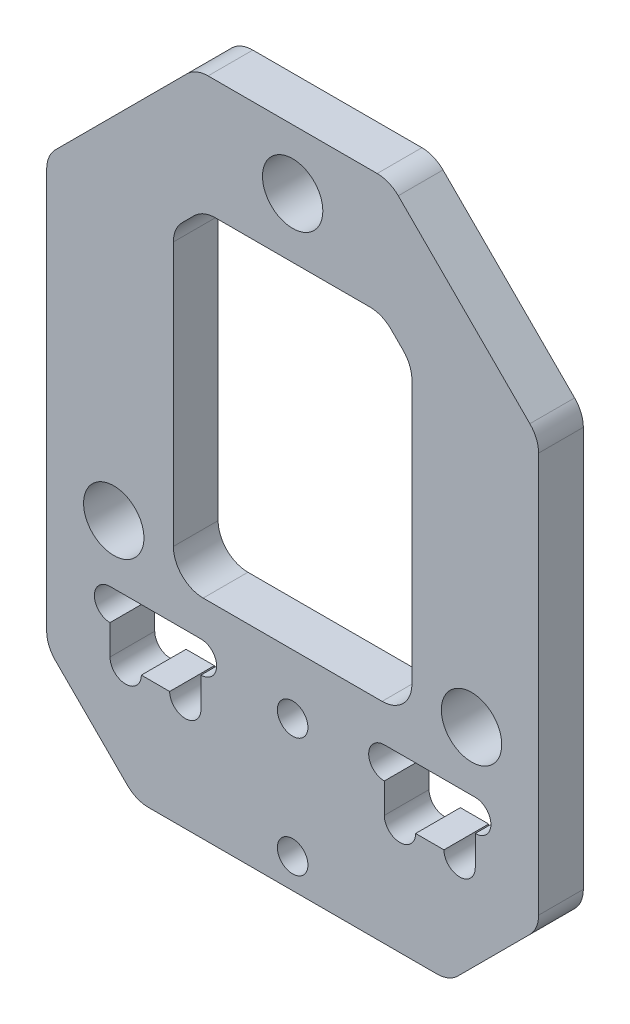
from build123d import *

# Parameters (mm, degrees)
SKETCH_1_W          = 33
SKETCH_1_H          = 44.5
EXTRUDE_1_DEPTH     = 3
SKETCH_2_R          = 2.025
SKETCH_2_R_2        = 1.025
CUT_EXTRUDE_1_DEPTH = 13
CHAMFER_1_SIZE      = 10
CUT_EXTRUDE_2_DEPTH = 13
FILLET_1_R          = 2
CHAMFER_2_SIZE      = 6
FILLET_2_R          = 2
SKETCH_4_W          = 6.1
SKETCH_4_H          = 4.1
CUT_EXTRUDE_3_DEPTH = 3
SKETCH_5_R          = 1.05
CUT_EXTRUDE_4_DEPTH = 3


with BuildPart() as part:
    # 草图1 → 凸台-拉伸1 (new body)
    with BuildSketch(Plane.XY):
        Rectangle(SKETCH_1_W, SKETCH_1_H)
    extrude(amount=EXTRUDE_1_DEPTH)

    # 草图2 → 切除-拉伸1 (cut)
    with BuildSketch(Plane.XY.offset(3)):
        with Locations((12, -6.75)):
            Circle(SKETCH_2_R)
        with Locations((-12, -6.75)):
            Circle(SKETCH_2_R)
        with Locations((0, 18.25)):
            Circle(SKETCH_2_R)
        with Locations((0, -12.25)):
            Circle(SKETCH_2_R_2)
        with Locations((0, -20.25)):
            Circle(SKETCH_2_R_2)
    extrude(amount=-CUT_EXTRUDE_1_DEPTH, mode=Mode.SUBTRACT)

    # 倒角1
    chamfer_1_edges = [part.edges().sort_by_distance(p)[0] for p in [
        (-16.5, 22.25, 1.5),
        (16.5, 22.25, 1.5),
    ]]
    chamfer(chamfer_1_edges, length=CHAMFER_1_SIZE)

    # 草图3 → 切除-拉伸2 (cut)
    with BuildSketch(Plane.XY.offset(3)):
        Polygon((-8, -8.25), (8, -8.25), (8, 12.264718626), (6.014718626, 14.25), (-6.014718626, 14.25), (-8, 12.264718626), align=None)
    extrude(amount=-CUT_EXTRUDE_2_DEPTH, mode=Mode.SUBTRACT)

    # 圆角1
    fillet_1_edges = [part.edges().sort_by_distance(p)[0] for p in [
        (-8, -8.25, 1.5),
        (-8, 12.264718626, 1.5),
        (-6.014718626, 14.25, 1.5),
        (6.014718626, 14.25, 1.5),
        (8, 12.264718626, 1.5),
        (8, -8.25, 1.5),
    ]]
    fillet(fillet_1_edges, radius=FILLET_1_R)

    # 倒角2
    chamfer_2_edges = [part.edges().sort_by_distance(p)[0] for p in [
        (16.5, -22.25, 1.5),
        (-16.5, -22.25, 1.5),
    ]]
    chamfer(chamfer_2_edges, length=CHAMFER_2_SIZE)

    # 圆角2
    fillet_2_edges = [part.edges().sort_by_distance(p)[0] for p in [
        (16.5, -16.25, 1.5),
        (-10.5, -22.25, 1.5),
        (10.5, -22.25, 1.5),
        (-16.5, -16.25, 1.5),
        (-6.5, 22.25, 1.5),
        (6.5, 22.25, 1.5),
        (16.5, 12.25, 1.5),
        (-16.5, 12.25, 1.5),
    ]]
    fillet(fillet_2_edges, radius=FILLET_2_R)

    # 草图4 → 切除-拉伸3 (cut)
    with BuildSketch(Plane.XY.offset(3)):
        with Locations((-9.2, -12.75)):
            Rectangle(SKETCH_4_W, SKETCH_4_H)
        with Locations((9.2, -12.75)):
            Rectangle(SKETCH_4_W, SKETCH_4_H)
    extrude(amount=-CUT_EXTRUDE_3_DEPTH, mode=Mode.SUBTRACT)

    # 草图5 → 切除-拉伸4 (cut)
    with BuildSketch(Plane.XY.offset(3)):
        with Locations((-11.2, -14.8)):
            Circle(SKETCH_5_R)
        with Locations((-7.2, -14.8)):
            Circle(SKETCH_5_R)
        with Locations((7.2, -14.8)):
            Circle(SKETCH_5_R)
        with Locations((11.2, -14.8)):
            Circle(SKETCH_5_R)
        with Locations((-12.25, -11.75)):
            Circle(SKETCH_5_R)
        with Locations((-6.15, -11.75)):
            Circle(SKETCH_5_R)
        with Locations((6.15, -11.75)):
            Circle(SKETCH_5_R)
        with Locations((12.25, -11.75)):
            Circle(SKETCH_5_R)
    extrude(amount=-CUT_EXTRUDE_4_DEPTH, mode=Mode.SUBTRACT)


solid = part.part
